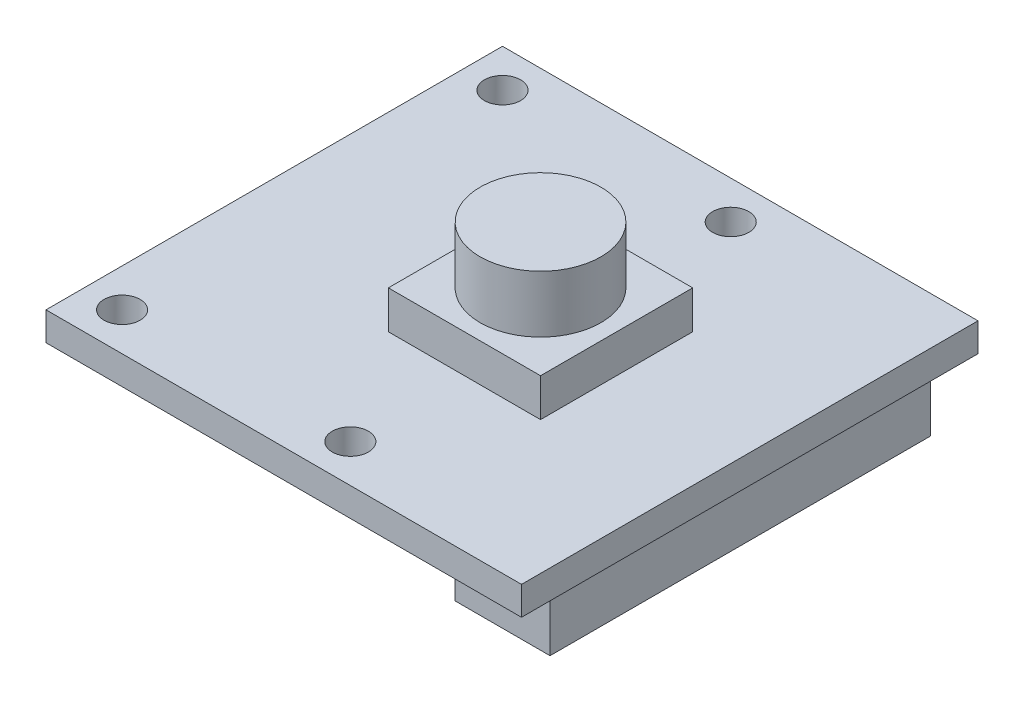
from build123d import *

# Parameters (mm, degrees)
SKETCH1_W           = 25
SKETCH1_H           = 24
BOSS_EXTRUDE1_DEPTH = 1.5
SKETCH2_W           = 8
SKETCH2_H           = 8
BOSS_EXTRUDE2_DEPTH = 2
SKETCH3_R           = 3.175
BOSS_EXTRUDE3_DEPTH = 3
SKETCH5_W           = 5
SKETCH5_H           = 20
BOSS_EXTRUDE4_DEPTH = 3
CUT_EXTRUDE1_REACH  = 20.035
SKETCH6_R           = 0.95


with BuildPart() as part:
    # Sketch1 → Boss-Extrude1 (new body)
    with BuildSketch(Plane(origin=(0, 0, 0), x_dir=(1, 0, 0), z_dir=(0, 1, 0))):
        Rectangle(SKETCH1_W, SKETCH1_H)
    extrude(amount=BOSS_EXTRUDE1_DEPTH)

    # Sketch2 → Boss-Extrude2 (add)
    with BuildSketch(Plane(origin=(0, 1.5, 0), x_dir=(1, 0, 0), z_dir=(0, 1, 0))):
        with Locations((1.5, 0)):
            Rectangle(SKETCH2_W, SKETCH2_H)
    extrude(amount=BOSS_EXTRUDE2_DEPTH)

    # Sketch3 → Boss-Extrude3 (add)
    with BuildSketch(Plane(origin=(0, 3.5, 0), x_dir=(1, 0, 0), z_dir=(0, 1, 0))):
        with Locations(Location((1.5, 0, 0), (0, 0, 270))):
            Circle(SKETCH3_R)
    extrude(amount=BOSS_EXTRUDE3_DEPTH)

    # Sketch5 → Boss-Extrude4 (add)
    with BuildSketch(Plane.XZ):
        with Locations((9.5, 0)):
            Rectangle(SKETCH5_W, SKETCH5_H)
    extrude(amount=BOSS_EXTRUDE4_DEPTH)

    # Sketch6 → Cut-Extrude1 (cut, up to next)
    with BuildSketch(Plane(origin=(0, 1.5, 0), x_dir=(1, 0, 0), z_dir=(0, 1, 0)), mode=Mode.PRIVATE) as cut_extrude1_sk1:
        with Locations(Location((-10.5, 10, 0), (0, 0, 270))):
            Circle(SKETCH6_R)
    cut_extrude1_tool1 = extrude(cut_extrude1_sk1.sketch, amount=-CUT_EXTRUDE1_REACH, mode=Mode.PRIVATE) & part.part
    # Sketch6 → Cut-Extrude1 (cut, up to next)
    with BuildSketch(Plane(origin=(0, 1.5, 0), x_dir=(1, 0, 0), z_dir=(0, 1, 0)), mode=Mode.PRIVATE) as cut_extrude1_sk2:
        with Locations(Location((1.5, 10, 0), (0, 0, 270))):
            Circle(SKETCH6_R)
    cut_extrude1_tool2 = extrude(cut_extrude1_sk2.sketch, amount=-CUT_EXTRUDE1_REACH, mode=Mode.PRIVATE) & part.part
    # Sketch6 → Cut-Extrude1 (cut, up to next)
    with BuildSketch(Plane(origin=(0, 1.5, 0), x_dir=(1, 0, 0), z_dir=(0, 1, 0)), mode=Mode.PRIVATE) as cut_extrude1_sk3:
        with Locations(Location((-10.5, -10, 0), (0, 0, 270))):
            Circle(SKETCH6_R)
    cut_extrude1_tool3 = extrude(cut_extrude1_sk3.sketch, amount=-CUT_EXTRUDE1_REACH, mode=Mode.PRIVATE) & part.part
    # Sketch6 → Cut-Extrude1 (cut, up to next)
    with BuildSketch(Plane(origin=(0, 1.5, 0), x_dir=(1, 0, 0), z_dir=(0, 1, 0)), mode=Mode.PRIVATE) as cut_extrude1_sk4:
        with Locations(Location((1.5, -10, 0), (0, 0, 270))):
            Circle(SKETCH6_R)
    cut_extrude1_tool4 = extrude(cut_extrude1_sk4.sketch, amount=-CUT_EXTRUDE1_REACH, mode=Mode.PRIVATE) & part.part
    add(cut_extrude1_tool1.solids().sort_by_distance((-10.5, 1.5, -10))[0], mode=Mode.SUBTRACT)
    add(cut_extrude1_tool2.solids().sort_by_distance((1.5, 1.5, -10))[0], mode=Mode.SUBTRACT)
    add(cut_extrude1_tool3.solids().sort_by_distance((-10.5, 1.5, 10))[0], mode=Mode.SUBTRACT)
    add(cut_extrude1_tool4.solids().sort_by_distance((1.5, 1.5, 10))[0], mode=Mode.SUBTRACT)


solid = part.part
